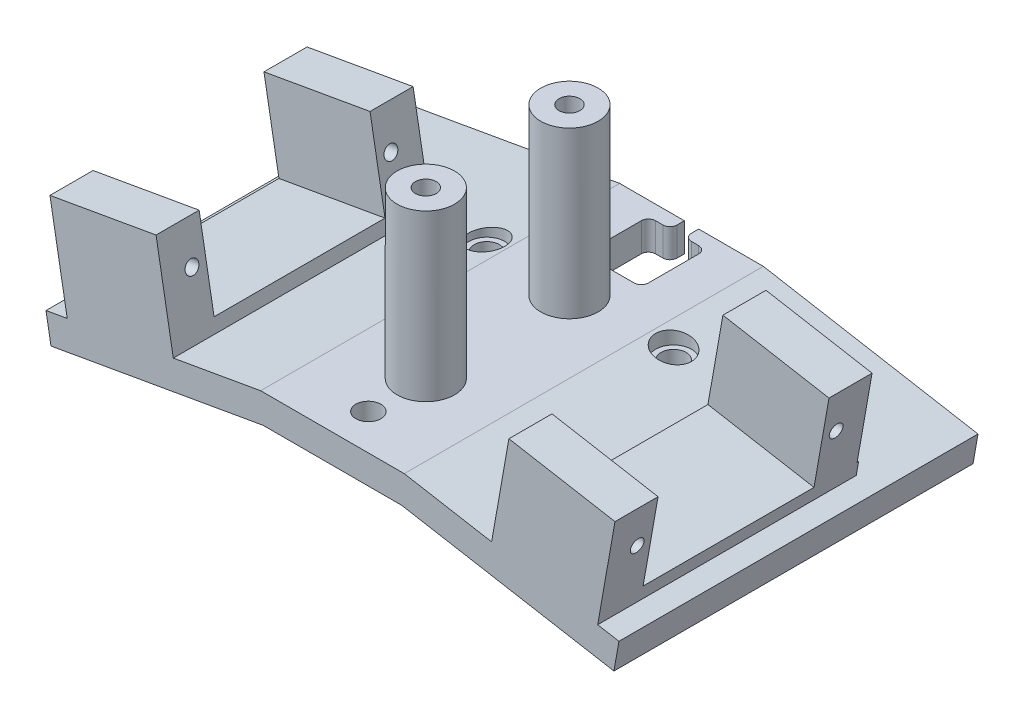
from build123d import *

# Parameters (mm, degrees)
EXTRUDE_1_DEPTH     = 25
EXTRUDE_2_DEPTH     = 36
SKETCH_3_W          = 15
SKETCH_3_H          = 6
EXTRUDE_3_DEPTH     = 12
SKETCH_4_R          = 0.95
CUT_EXTRUDE_1_DEPTH = 21
SKETCH_5_R          = 4
SKETCH_5_R_2        = 1.45
EXTRUDE_4_DEPTH     = 23
SKETCH_6_R          = 1.75
CUT_EXTRUDE_2_DEPTH = 20
SKETCH_7_R          = 2.5
CUT_EXTRUDE_3_DEPTH = 2
CUT_EXTRUDE_4_DEPTH = 53.393911874
FILLET_4_R          = 1


with BuildPart() as part:
    # 草图1 → 凸台-拉伸1 (new, symmetric)
    with BuildSketch(Plane.XY):
        Polygon((0, 0), (9.650045346, 0), (39.194277936, -5.20944533), (39.888870647, -1.270214318), (10, 4), (0, 4), align=None)
    extrude_1 = extrude(amount=EXTRUDE_1_DEPTH, both=True)

    # 草图2 → 凸台-拉伸2 (add)
    with BuildSketch(Plane.XY.offset(25)):
        Polygon((22.162331093, 1.85545288), (22.483580221, 3.677347223), (37.255696517, 1.072624558), (36.934447388, -0.749269785), align=None)
    extrude_2 = extrude(amount=-EXTRUDE_2_DEPTH)

    # 草图3 → 凸台-拉伸3 (add)
    with BuildSketch(Plane(origin=(1.306826311, 7.411380301, 0), x_dir=(0.9848077530122079, -0.1736481776669312, 0), z_dir=(0.1736481776669312, 0.9848077530122079, 0))):
        with Locations((29.003439474, -22)):
            Rectangle(SKETCH_3_W, SKETCH_3_H)
        with Locations((29.003439474, 7.8)):
            Rectangle(SKETCH_3_W, SKETCH_3_H)
    extrude_3 = extrude(amount=EXTRUDE_3_DEPTH)

    # 草图4 → 切除-拉伸1 (cut)
    with BuildSketch(Plane(origin=(35.948870205, -6.338755743, 0), x_dir=(0, 0, -1), z_dir=(0.9848077530122081, -0.17364817766693072, 0))):
        with Locations(Location((-20.95, 14.025712789, 0), (0, 0, 90))):
            Circle(SKETCH_4_R)
        with Locations(Location((6.75, 14.025712789, 0), (0, 0, 90))):
            Circle(SKETCH_4_R)
    cut_extrude_1 = extrude(amount=-CUT_EXTRUDE_1_DEPTH, mode=Mode.SUBTRACT)

    # 镜向1: 凸台-拉伸1, 凸台-拉伸2, 凸台-拉伸3, 切除-拉伸1 across plane
    add(extrude_1.mirror(Plane(origin=(0, 0, 0), x_dir=(0, 0, 1), z_dir=(1, 0, 0))))
    add(extrude_2.mirror(Plane(origin=(0, 0, 0), x_dir=(0, 0, 1), z_dir=(1, 0, 0))))
    add(extrude_3.mirror(Plane(origin=(0, 0, 0), x_dir=(0, 0, 1), z_dir=(1, 0, 0))))
    add(cut_extrude_1.mirror(Plane(origin=(0, 0, 0), x_dir=(0, 0, 1), z_dir=(1, 0, 0))), mode=Mode.SUBTRACT)

    # 草图5 → 凸台-拉伸4 (add)
    # profile 1 of 2: a face of its own
    with BuildSketch(Plane(origin=(0, 4, 0), x_dir=(1, 0, 0), z_dir=(0, 1, 0))):
        with Locations((0, -12)):
            Circle(SKETCH_5_R)
        with Locations(Location((0, -12, 0), (0, 0, 180))):
            Circle(SKETCH_5_R_2, mode=Mode.SUBTRACT)
    # profile 2 of 2: a face of its own
    with BuildSketch(Plane(origin=(0, 4, 0), x_dir=(1, 0, 0), z_dir=(0, 1, 0))):
        with Locations((0, 8)):
            Circle(SKETCH_5_R)
        with Locations(Location((0, 8, 0), (0, 0, 180))):
            Circle(SKETCH_5_R_2, mode=Mode.SUBTRACT)
    extrude(amount=EXTRUDE_4_DEPTH)

    # 草图6 → 切除-拉伸2 (cut)
    with BuildSketch(Plane(origin=(0, 4, 0), x_dir=(1, 0, 0), z_dir=(0, 1, 0))):
        with Locations(Location((0, -20, 0), (0, 0, 180))):
            Circle(SKETCH_6_R)
        with Locations((-13, 9.5)):
            Circle(SKETCH_6_R)
        with Locations(Location((13, 9.5, 0), (0, 0, 180))):
            Circle(SKETCH_6_R)
    extrude(amount=-CUT_EXTRUDE_2_DEPTH, mode=Mode.SUBTRACT)

    # 草图7 → 切除-拉伸3 (cut)
    with BuildSketch(Plane(origin=(0, 4, 0), x_dir=(1, 0, 0), z_dir=(0, 1, 0))):
        with Locations(Location((-13, 9.5, 0), (0, 0, 180))):
            Circle(SKETCH_7_R)
        with Locations(Location((13, 9.5, 0), (0, 0, 180))):
            Circle(SKETCH_7_R)
    extrude(amount=-CUT_EXTRUDE_3_DEPTH, mode=Mode.SUBTRACT)

    # 草图8 → 切除-拉伸4 (cut, through all)
    with BuildSketch(Plane(origin=(0, 4, 0), x_dir=(1, 0, 0), z_dir=(0, 1, 0))):
        Polygon((-4, 23), (-1, 23), (-1, 25), (1, 25), (1, 23), (4, 23), (4, 14), (-4, 14), align=None)
    extrude(amount=-CUT_EXTRUDE_4_DEPTH, mode=Mode.SUBTRACT)

    # 圆角4
    fillet_4_edges = [part.edges().sort_by_distance(p)[0] for p in [
        (4, 2, -23),
        (4, 2, -14),
        (-4, 2, -14),
        (-4, 2, -23),
        (1, 2, -23),
        (-1, 2, -23),
    ]]
    fillet(fillet_4_edges, radius=FILLET_4_R)


solid = part.part
